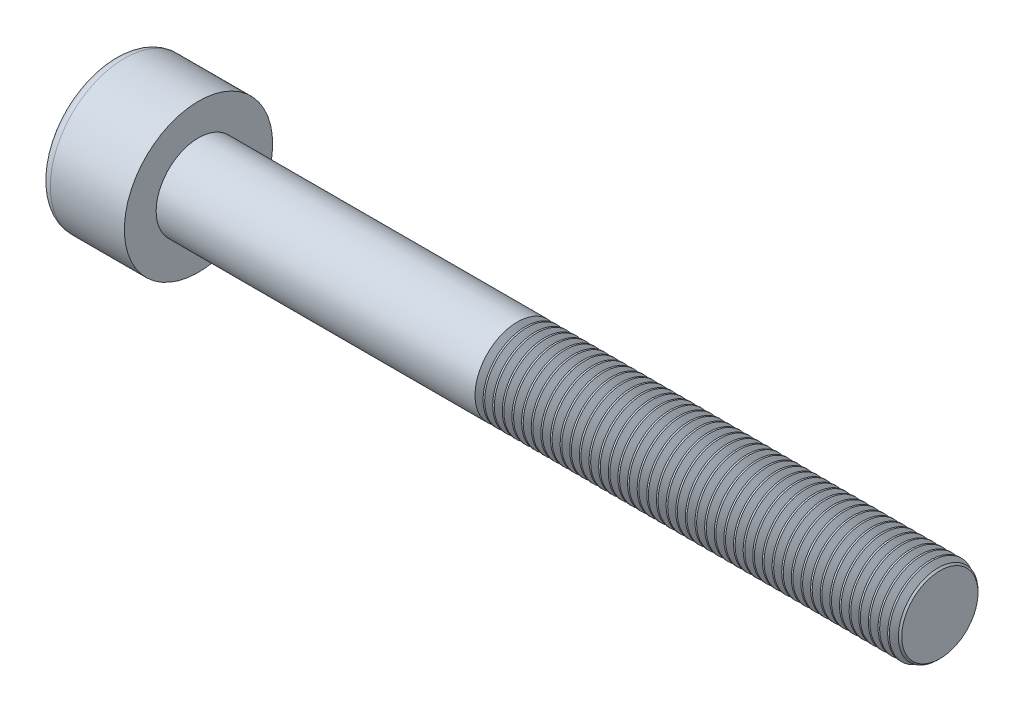
from build123d import *

# Parameters (mm, degrees)
SKETCH1_R           = 3.5
BASEHEAD_DEPTH      = 4
SKETCH2_R           = 2
BASEBODY_DEPTH      = 35
HEXAGONSOCKET_DEPTH = 2
TOPFILLET_R         = 0.5
CHAMFER1_SIZE       = 0.2
LPATTERN10_COUNT    = 44
LPATTERN10_PITCH    = 0.4548


with BuildPart() as part:
    # Sketch1 → BaseHead (new body)
    with BuildSketch(Plane(origin=(0, 0, 0), x_dir=(0, 0, -1), z_dir=(1, 0, 0))):
        Circle(SKETCH1_R)
    extrude(amount=BASEHEAD_DEPTH)

    # Sketch2 → BaseBody (add)
    with BuildSketch(Plane(origin=(4, 0, 0), x_dir=(0, 0, -1), z_dir=(1, 0, 0))):
        Circle(SKETCH2_R)
    extrude(amount=BASEBODY_DEPTH)

    # Sketch3 → HexagonSocket (cut)
    with BuildSketch(Plane(origin=(0, 0, 0), x_dir=(0, 0, -1), z_dir=(1, 0, 0))):
        Polygon((1.732050808, 0), (0.866025404, 1.5), (-0.866025404, 1.5), (-1.732050808, 0), (-0.866025404, -1.5), (0.866025404, -1.5), align=None)
    extrude(amount=HEXAGONSOCKET_DEPTH, mode=Mode.SUBTRACT)

    # Sketch4 → Cut-Revolve1 (revolve, cut)
    with BuildSketch(Plane(origin=(-4.19613823, 0.75, 0), x_dir=(-1, 0, 0), z_dir=(0, 0, 1)), mode=Mode.PRIVATE) as cut_revolve1_sk:
        Polygon((-6.19613823, 2.25), (-7.062163633, 0.75), (-6.19613823, 0.75), align=None)
    revolve(cut_revolve1_sk.sketch.rotate(Axis((0.838992387, 0, 0), (-1, 0, 0)), 90), axis=Axis((0.838992387, 0, 0), (-1, 0, 0)), mode=Mode.SUBTRACT)

    # TopFillet
    topfillet_edges = [part.edges().sort_by_distance(p)[0] for p in [
        (0, 0, 3.5),
    ]]
    fillet(topfillet_edges, radius=TOPFILLET_R)

    # Chamfer1
    chamfer1_edges = [part.edges().sort_by_distance(p)[0] for p in [
        (39, 0, 2),
    ]]
    chamfer(chamfer1_edges, length=CHAMFER1_SIZE)

    # Sketch5 → Cut-Revolve10 (revolve, cut)
    with BuildSketch(Plane.XY, mode=Mode.PRIVATE) as cut_revolve10_sk:
        Polygon((38.8, 1.671776372), (38.9895, 2), (38.9895, 2.379), (38.6105, 2.379), (38.6105, 2), align=None)
    cut_revolve10 = revolve(cut_revolve10_sk.sketch.rotate(Axis((0, 0, 0), (1, 0, 0)), 90), axis=Axis((0, 0, 0), (1, 0, 0)), mode=Mode.SUBTRACT)

    # LPattern10: Cut-Revolve10 ×44
    with Locations(*[(-i * LPATTERN10_PITCH, 0, 0) for i in range(1, LPATTERN10_COUNT)]):
        add(cut_revolve10, mode=Mode.SUBTRACT)


solid = part.part
